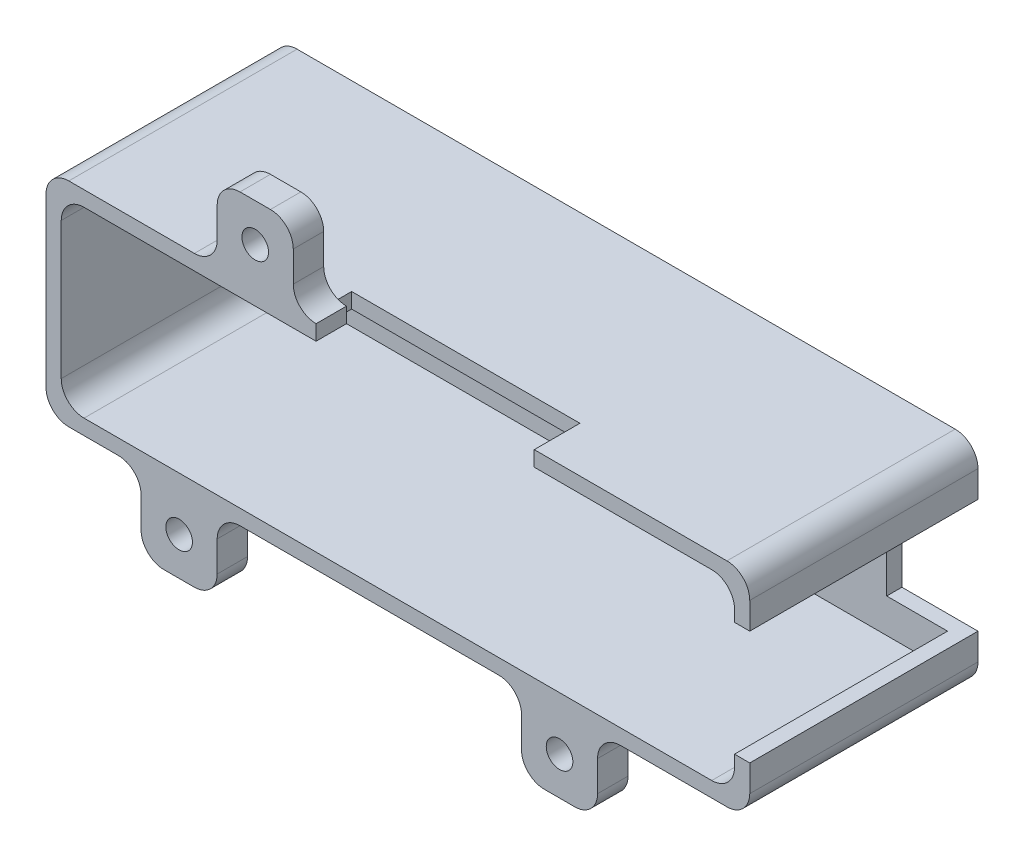
from build123d import *

# Parameters (mm, degrees)
SKETCH1_W           = 12.7
SKETCH1_H           = 38.1
SKETCH1_W_2         = 104.775
BOSS_EXTRUDE1_DEPTH = 35.56
SKETCH11_W          = 112.395
SKETCH11_H          = 30.48
CUT_EXTRUDE9_DEPTH  = 35.56
SKETCH5_W           = 12.7
SKETCH5_H           = 5.08
BOSS_EXTRUDE2_DEPTH = 12.7
SKETCH7_W           = 12.7
SKETCH7_H           = 5.08
BOSS_EXTRUDE3_DEPTH = 12.7
SKETCH8_R           = 2.2225
CUT_EXTRUDE6_DEPTH  = 88.497032271
FILLET1_R           = 3.81
SKETCH9_W           = 12.7
SKETCH9_H           = 19.05
CUT_EXTRUDE7_DEPTH  = 90.537814672
SKETCH10_W          = 25.4
SKETCH10_H          = 7.62
CUT_EXTRUDE8_DEPTH  = 8.89


with BuildPart() as part:
    # Sketch1 → Boss-Extrude1 (new body)
    with BuildSketch(Plane(origin=(0, 0, 0), x_dir=(1, 0, 0), z_dir=(0, 1, 0))):
        with Locations((58.7375, 0)):
            Rectangle(SKETCH1_W, SKETCH1_H)
        Rectangle(SKETCH1_W_2, SKETCH1_H)
    extrude(amount=BOSS_EXTRUDE1_DEPTH)

    # Sketch11 → Cut-Extrude9 (cut)
    with BuildSketch(Plane.XY.offset(19.05)):
        with Locations((6.35, 17.78)):
            Rectangle(SKETCH11_W, SKETCH11_H)
    extrude(amount=-CUT_EXTRUDE9_DEPTH, mode=Mode.SUBTRACT)

    # Sketch5 → Boss-Extrude2 (add)
    with BuildSketch(Plane.XZ):
        with Locations((-30.1625, 16.51)):
            Rectangle(SKETCH5_W, SKETCH5_H)
        with Locations((33.3375, 16.51)):
            Rectangle(SKETCH5_W, SKETCH5_H)
    extrude(amount=BOSS_EXTRUDE2_DEPTH)

    # Sketch7 → Boss-Extrude3 (add)
    with BuildSketch(Plane(origin=(0, 35.56, 0), x_dir=(1, 0, 0), z_dir=(0, 1, 0))):
        with Locations((-17.4625, -16.51)):
            Rectangle(SKETCH7_W, SKETCH7_H)
    extrude(amount=BOSS_EXTRUDE3_DEPTH)

    # Sketch8 → Cut-Extrude6 (cut, through all)
    with BuildSketch(Plane(origin=(0, 0, 13.97), x_dir=(-1, 0, 0), z_dir=(0, 0, -1))):
        with Locations((-33.3375, -6.35)):
            Circle(SKETCH8_R)
        with Locations((30.1625, -6.35)):
            Circle(SKETCH8_R)
        with Locations((17.4625, 41.91)):
            Circle(SKETCH8_R)
    extrude(amount=-CUT_EXTRUDE6_DEPTH, mode=Mode.SUBTRACT)

    # Fillet1
    fillet1_edges = [part.edges().sort_by_distance(p)[0] for p in [
        (65.0875, 35.56, 0),
        (62.5475, 2.54, 1.27),
        (62.5475, 33.02, 1.27),
        (-49.8475, 33.02, 1.27),
        (-49.8475, 2.54, 1.27),
        (-52.3875, 35.56, 0),
        (-36.5125, 0, 16.51),
        (-23.8125, -12.7, 16.51),
        (-36.5125, -12.7, 16.51),
        (-23.8125, 0, 16.51),
        (39.6875, 0, 16.51),
        (26.9875, 0, 16.51),
        (39.6875, -12.7, 16.51),
        (26.9875, -12.7, 16.51),
        (-11.1125, 35.56, 16.51),
        (-23.8125, 35.56, 16.51),
        (-52.3875, 0, 0),
        (-11.1125, 48.26, 16.51),
        (-23.8125, 48.26, 16.51),
        (65.0875, 0, 0),
    ]]
    fillet(fillet1_edges, radius=FILLET1_R)

    # Sketch9 → Cut-Extrude7 (cut, through all)
    with BuildSketch(Plane(origin=(0, 0, -19.05), x_dir=(-1, 0, 0), z_dir=(0, 0, -1))):
        with Locations((-58.7375, 17.78)):
            Rectangle(SKETCH9_W, SKETCH9_H)
    extrude(amount=-CUT_EXTRUDE7_DEPTH, mode=Mode.SUBTRACT)

    # Sketch10 → Cut-Extrude8 (cut)
    with BuildSketch(Plane(origin=(0, 35.56, 0), x_dir=(1, 0, 0), z_dir=(0, 1, 0))):
        Polygon((-7.3025, -19.05), (3.712545586, -19.05), (3.712545586, -11.43), (-8.987454414, -11.43), (-8.987454414, -13.97), (-7.3025, -13.97), align=None)
        with Locations((16.412545586, -15.24)):
            Rectangle(SKETCH10_W, SKETCH10_H)
    extrude(amount=-CUT_EXTRUDE8_DEPTH, mode=Mode.SUBTRACT)


solid = part.part
